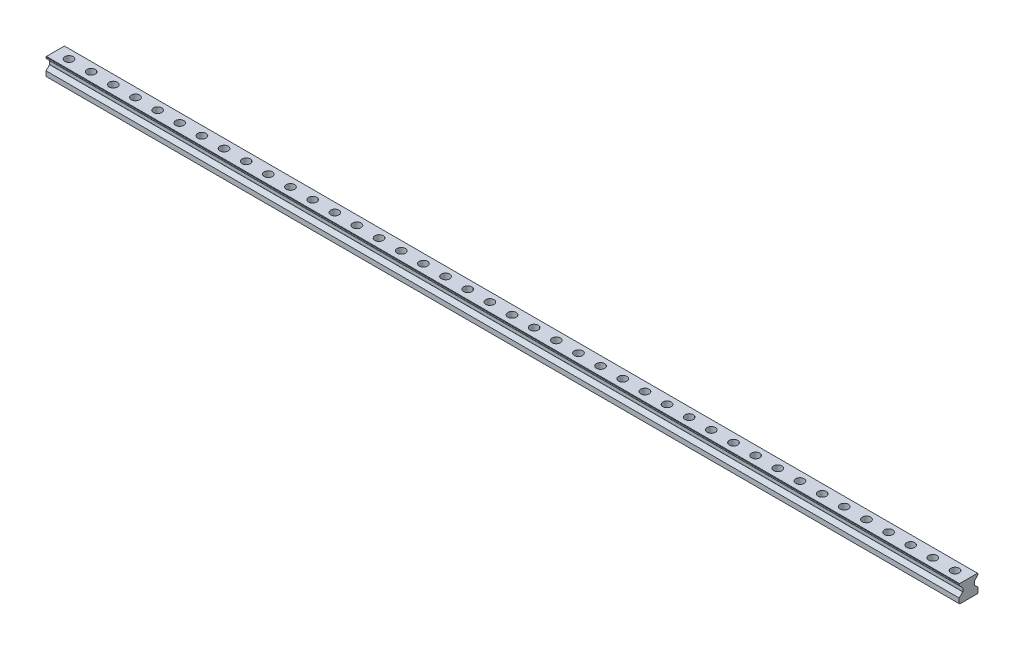
from build123d import *

# Parameters (mm, degrees)
BOSS_EXTRUDE2_DEPTH            = 824.5
CBORE_FOR_M8_SHCS1_D           = 9
CBORE_FOR_M8_SHCS1_CBORE_D     = 15
CBORE_FOR_M8_SHCS1_CBORE_DEPTH = 17
LPATTERN1_COUNT                = 41
LPATTERN1_PITCH                = 40


with BuildPart() as part:
    # Sketch2 → Boss-Extrude2 (new, symmetric)
    with BuildSketch(Plane(origin=(0, 0, 0), x_dir=(0, 0, -1), z_dir=(1, 0, 0))):
        with BuildLine():
            Line((10.617157288, 22.759079349), (17, 29.141922061))
            Line((17, 29.141922061), (17, 31.25))
            Line((17, 31.25), (16.25, 32))
            Line((16.25, 32), (-16.25, 32))
            Line((-16.25, 32), (-17, 31.25))
            Line((-17, 31.25), (-17, 29.141922061))
            Line((-17, 29.141922061), (-10.617157288, 22.759079349))
            ThreePointArc((-10.617157288, 22.759079349), (-10.530448187, 22.629310009), (-10.5, 22.476236636))
            Line((-10.5, 22.476236636), (-10.5, 16.523763364))
            ThreePointArc((-10.5, 16.523763364), (-10.530448187, 16.370689991), (-10.617157288, 16.240920651))
            Line((-10.617157288, 16.240920651), (-17, 9.858077939))
            Line((-17, 9.858077939), (-17, 1))
            Line((-17, 1), (-16, 0))
            Line((-16, 0), (16, 0))
            Line((16, 0), (17, 1))
            Line((17, 1), (17, 9.858077939))
            Line((17, 9.858077939), (10.617157288, 16.240920651))
            ThreePointArc((10.617157288, 16.240920651), (10.530448187, 16.370689991), (10.5, 16.523763364))
            Line((10.5, 16.523763364), (10.5, 22.476236636))
            ThreePointArc((10.5, 22.476236636), (10.530448187, 22.629310009), (10.617157288, 22.759079349))
        make_face()
    extrude(amount=BOSS_EXTRUDE2_DEPTH, both=True)

    # CBORE for M8 SHCS1 (through all)
    with Locations(Plane(origin=(0, 32, 0), x_dir=(-1, 0, 0), z_dir=(0, 1, 0))):
        with Locations((-800, 0)):
            cbore_for_m8_shcs1 = CounterBoreHole(CBORE_FOR_M8_SHCS1_D / 2, CBORE_FOR_M8_SHCS1_CBORE_D / 2, CBORE_FOR_M8_SHCS1_CBORE_DEPTH)

    # LPattern1: CBORE for M8 SHCS1 ×41
    with Locations(*[(-i * LPATTERN1_PITCH, 0, 0) for i in range(1, LPATTERN1_COUNT)]):
        add(cbore_for_m8_shcs1, mode=Mode.SUBTRACT)


solid = part.part
